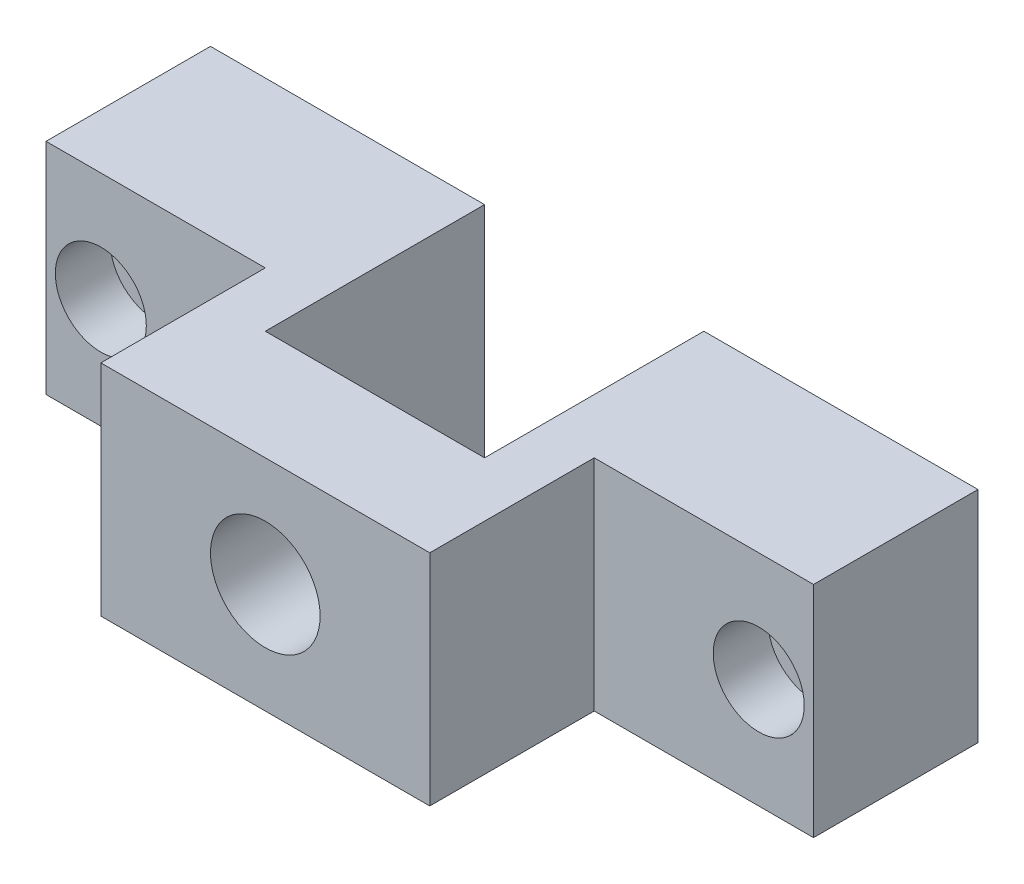
from build123d import *

# Parameters (mm, degrees)
SKETCH1_W           = 70
SKETCH1_H           = 20
SKETCH1_R           = 2.5
BOSS_EXTRUDE1_DEPTH = 15
SKETCH2_W           = 30
SKETCH2_H           = 20
BOSS_EXTRUDE2_DEPTH = 15
SKETCH4_W           = 20
SKETCH4_H           = 20
CUT_EXTRUDE1_DEPTH  = 79.74007874
SKETCH5_R           = 5
CUT_EXTRUDE2_DEPTH  = 79.74007874
SKETCH6_R           = 4.15
CUT_EXTRUDE3_DEPTH  = 5
SKETCH7_R           = 4.15
CUT_EXTRUDE4_DEPTH  = 5


with BuildPart() as part:
    # Sketch1 → Boss-Extrude1 (new body)
    with BuildSketch(Plane.XY):
        with Locations((35, 10)):
            Rectangle(SKETCH1_W, SKETCH1_H)
        with Locations((65, 10)):
            Circle(SKETCH1_R, mode=Mode.SUBTRACT)
        with Locations((5, 10)):
            Circle(SKETCH1_R, mode=Mode.SUBTRACT)
    extrude(amount=BOSS_EXTRUDE1_DEPTH)

    # Sketch2 → Boss-Extrude2 (add)
    with BuildSketch(Plane.XY.offset(15)):
        with Locations((35, 10)):
            Rectangle(SKETCH2_W, SKETCH2_H)
    extrude(amount=BOSS_EXTRUDE2_DEPTH)

    # Sketch4 → Cut-Extrude1 (cut, through all)
    with BuildSketch(Plane(origin=(0, 20, 0), x_dir=(1, 0, 0), z_dir=(0, 1, 0))):
        with Locations((35, -10)):
            Rectangle(SKETCH4_W, SKETCH4_H)
    extrude(amount=-CUT_EXTRUDE1_DEPTH, mode=Mode.SUBTRACT)

    # Sketch5 → Cut-Extrude2 (cut, through all)
    with BuildSketch(Plane.XY.offset(30)):
        with Locations((35, 10)):
            Circle(SKETCH5_R)
    extrude(amount=-CUT_EXTRUDE2_DEPTH, mode=Mode.SUBTRACT)

    # Sketch6 → Cut-Extrude3 (cut)
    with BuildSketch(Plane.XY.offset(15)):
        with Locations((5, 10)):
            Circle(SKETCH6_R)
    extrude(amount=-CUT_EXTRUDE3_DEPTH, mode=Mode.SUBTRACT)

    # Sketch7 → Cut-Extrude4 (cut)
    with BuildSketch(Plane.XY.offset(15)):
        with Locations((65, 10)):
            Circle(SKETCH7_R)
    extrude(amount=-CUT_EXTRUDE4_DEPTH, mode=Mode.SUBTRACT)


solid = part.part
